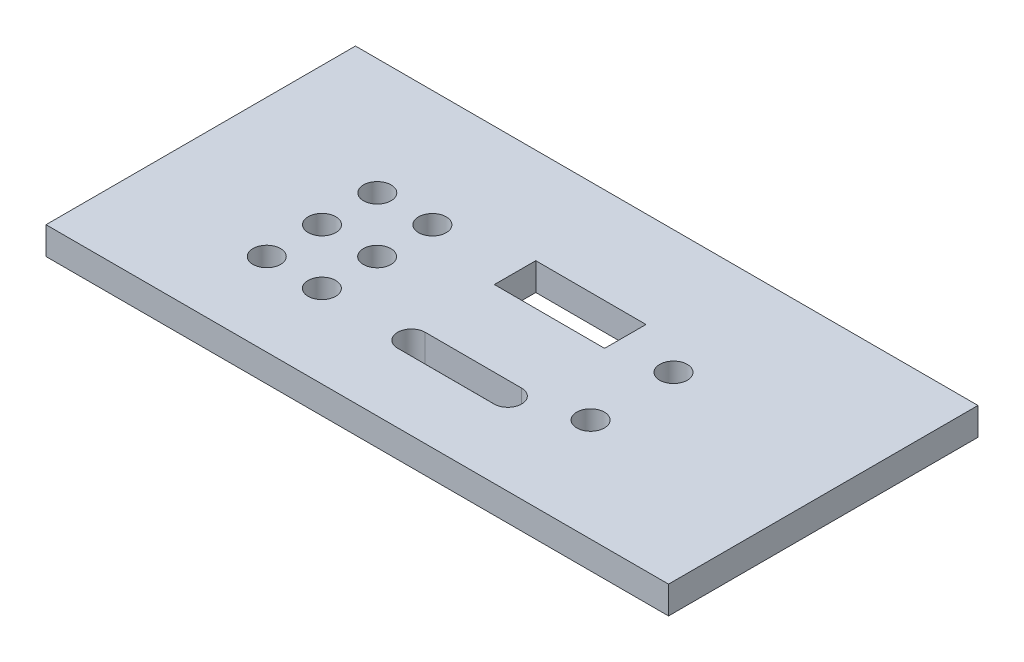
from build123d import *

# Parameters (mm, degrees)
SKETCH2_W           = 225.601042676
SKETCH2_H           = 112.148495204
BOSS_EXTRUDE1_DEPTH = 10
SKETCH3_R           = 5
CUT_EXTRUDE1_DEPTH  = 127.365655375


with BuildPart() as part:
    # Sketch2 → Boss-Extrude1 (new body)
    with BuildSketch(Plane(origin=(0, 0, 0), x_dir=(1, 0, 0), z_dir=(0, 1, 0))):
        Rectangle(SKETCH2_W, SKETCH2_H)
    extrude(amount=BOSS_EXTRUDE1_DEPTH)

    # Sketch3 → Cut-Extrude1 (cut, through all)
    with BuildSketch(Plane(origin=(0, 10, 0), x_dir=(1, 0, 0), z_dir=(0, 1, 0))):
        with Locations(Location((47.181724175, -18.701420381, 0), (0, 0, 270))):
            Circle(SKETCH3_R)
        with Locations(Location((47.224119262, 11.298549663, 0), (0, 0, 270))):
            Circle(SKETCH3_R)
        with Locations(Location((-42.772257947, 13.925732428, 0), (0, 0, 270))):
            Circle(SKETCH3_R)
        with Locations(Location((-62.772237976, 13.953995819, 0), (0, 0, 270))):
            Circle(SKETCH3_R)
        with Locations(Location((-62.800501368, -6.04598421, 0), (0, 0, 270))):
            Circle(SKETCH3_R)
        with Locations(Location((-62.828764759, -26.04596424, 0), (0, 0, 270))):
            Circle(SKETCH3_R)
        with Locations(Location((-42.800521338, -6.074247602, 0), (0, 0, 270))):
            Circle(SKETCH3_R)
        with Locations(Location((-42.82878473, -26.074227631, 0), (0, 0, 270))):
            Circle(SKETCH3_R)
        Polygon((-12.761689131, 21.383329852), (27.238270928, 21.326803069), (27.217073385, 6.326818047), (-12.782886674, 6.38334483), align=None)
        with BuildLine():
            Line((24.664082022, -31.169611585), (-10.33588303, -31.12015065))
            ThreePointArc((-10.33588303, -31.12015065), (-15.328812189, -26.113089794), (-10.321751334, -21.120160635))
            Line((-10.321751334, -21.120160635), (24.678213718, -21.16962157))
            ThreePointArc((24.678213718, -21.16962157), (29.671142877, -26.176682425), (24.664082022, -31.169611585))
        make_face()
    extrude(amount=-CUT_EXTRUDE1_DEPTH, mode=Mode.SUBTRACT)


solid = part.part
